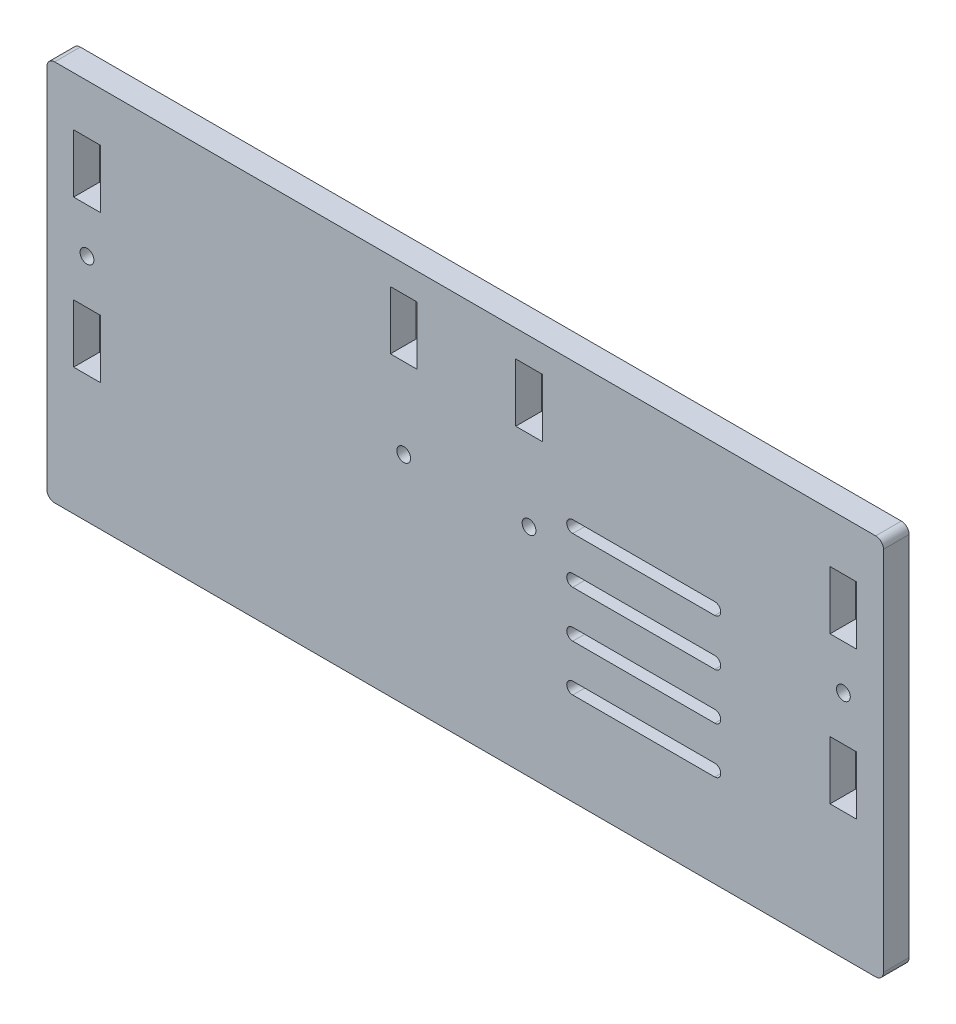
from build123d import *

# Parameters (mm, degrees)
MODEL_R             = 1.775
MODEL_W             = 6.86
MODEL_H             = 15
BOSS_EXTRUDE1_DEPTH = 6.6


with BuildPart() as part:
    # Model → Boss-Extrude1 (new body)
    with BuildSketch(Plane.XY):
        with BuildLine():
            Line((213.28, 98.3), (2, 98.3))
            ThreePointArc((2, 98.3), (0.585786438, 97.714213562), (0, 96.3))
            Line((0, 96.3), (0, 2))
            ThreePointArc((0, 2), (0.585786438, 0.585786438), (2, 0))
            Line((2, 0), (213.28, 0))
            ThreePointArc((213.28, 0), (214.694213562, 0.585786438), (215.28, 2))
            Line((215.28, 2), (215.28, 96.3))
            ThreePointArc((215.28, 96.3), (214.694213562, 97.714213562), (213.28, 98.3))
        make_face()
        with Locations((10.310000096, 59.15)):
            Circle(MODEL_R, mode=Mode.SUBTRACT)
        with Locations((204.970000096, 59.15)):
            Circle(MODEL_R, mode=Mode.SUBTRACT)
        with Locations((91.820001761, 55.71)):
            Circle(MODEL_R, mode=Mode.SUBTRACT)
        with Locations((124.08000176, 55.71)):
            Circle(MODEL_R, mode=Mode.SUBTRACT)
        with BuildLine():
            Line((135.316050952, 59.858691011), (171.867952568, 59.858691011))
            ThreePointArc((171.867952568, 59.858691011), (173.409261558, 61.4), (171.867952568, 62.941308989))
            Line((171.867952568, 62.941308989), (135.316050952, 62.941308989))
            ThreePointArc((135.316050952, 62.941308989), (133.774741963, 61.4), (135.316050952, 59.858691011))
        make_face(mode=Mode.SUBTRACT)
        with BuildLine():
            Line((135.316050952, 47.858691011), (171.867952568, 47.858691011))
            ThreePointArc((171.867952568, 47.858691011), (173.409261558, 49.4), (171.867952568, 50.941308989))
            Line((171.867952568, 50.941308989), (135.316050952, 50.941308989))
            ThreePointArc((135.316050952, 50.941308989), (133.774741963, 49.4), (135.316050952, 47.858691011))
        make_face(mode=Mode.SUBTRACT)
        with Locations((91.820001761, 83.92)):
            Rectangle(MODEL_W, MODEL_H, mode=Mode.SUBTRACT)
        with Locations((124.08000176, 83.92)):
            Rectangle(MODEL_W, MODEL_H, mode=Mode.SUBTRACT)
        with Locations((204.970000096, 40.2)):
            Rectangle(MODEL_W, MODEL_H, mode=Mode.SUBTRACT)
        with Locations((204.970000096, 78.1)):
            Rectangle(MODEL_W, MODEL_H, mode=Mode.SUBTRACT)
        with Locations((10.310000096, 40.2)):
            Rectangle(MODEL_W, MODEL_H, mode=Mode.SUBTRACT)
        with Locations((10.310000096, 78.1)):
            Rectangle(MODEL_W, MODEL_H, mode=Mode.SUBTRACT)
        with BuildLine():
            Line((171.867952568, 26.941308989), (135.316050952, 26.941308989))
            ThreePointArc((135.316050952, 26.941308989), (133.774741963, 25.4), (135.316050952, 23.858691011))
            Line((135.316050952, 23.858691011), (171.867952568, 23.858691011))
            ThreePointArc((171.867952568, 23.858691011), (173.409261558, 25.4), (171.867952568, 26.941308989))
        make_face(mode=Mode.SUBTRACT)
        with BuildLine():
            Line((171.867952568, 38.941308989), (135.316050952, 38.941308989))
            ThreePointArc((135.316050952, 38.941308989), (133.774741963, 37.4), (135.316050952, 35.858691011))
            Line((135.316050952, 35.858691011), (171.867952568, 35.858691011))
            ThreePointArc((171.867952568, 35.858691011), (173.409261558, 37.4), (171.867952568, 38.941308989))
        make_face(mode=Mode.SUBTRACT)
    extrude(amount=BOSS_EXTRUDE1_DEPTH)


solid = part.part
